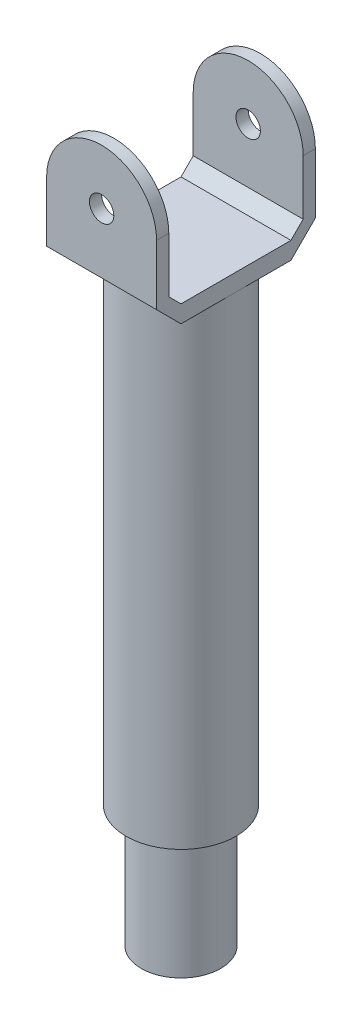
from build123d import *

# Parameters (mm, degrees)
SKETCH1_R               = 32.5
BOSS_EXTRUDE1_DEPTH     = 100
SKETCH2_R               = 45
BOSS_EXTRUDE2_DEPTH     = 400
BOSS_EXTRUDE3_DEPTH     = 45
CUT_EXTRUDE2_DEPTH      = 616.568842616
CUT_EXTRUDE2_DEPTH_BACK = 616.568842616
SKETCH7_R               = 10


with BuildPart() as part:
    # Sketch1 → Boss-Extrude1 (new body)
    with BuildSketch(Plane(origin=(0, 0, 0), x_dir=(1, 0, 0), z_dir=(0, 1, 0))):
        with Locations(Location((0, 0, 0), (0, 0, 270))):
            Circle(SKETCH1_R)
    extrude(amount=BOSS_EXTRUDE1_DEPTH)

    # Sketch2 → Boss-Extrude2 (add)
    with BuildSketch(Plane(origin=(0, 100, 0), x_dir=(1, 0, 0), z_dir=(0, 1, 0))):
        with Locations(Location((0, 0, 0), (0, 0, 270))):
            Circle(SKETCH2_R)
    extrude(amount=BOSS_EXTRUDE2_DEPTH)

    # Sketch6 → Boss-Extrude3 (add, symmetric)
    with BuildSketch(Plane(origin=(0, 0, 0), x_dir=(0, 0, -1), z_dir=(1, 0, 0))):
        Polygon((-45, 500), (-55, 510), (-55, 600), (-65, 600), (-65, 505.857864376), (-45, 485.857864376), (45, 485.857864376), (65, 505.857864376), (65, 600), (55, 600), (55, 510), (45, 500), align=None)
    extrude(amount=BOSS_EXTRUDE3_DEPTH, both=True)

    # Sketch7 → Cut-Extrude2 (cut, two sides: drawn at the far end of the back side and taken through both)
    with BuildSketch(Plane.XY.offset(65).offset(-CUT_EXTRUDE2_DEPTH_BACK)):
        with Locations((0, 555)):
            Circle(SKETCH7_R)
        with BuildLine():
            Line((-45, 555), (-45, 605))
            Line((-45, 605), (45, 605))
            Line((45, 605), (45, 555))
            ThreePointArc((45, 555), (0, 600), (-45, 555))
        make_face()
    extrude(amount=CUT_EXTRUDE2_DEPTH + CUT_EXTRUDE2_DEPTH_BACK, mode=Mode.SUBTRACT)


solid = part.part
